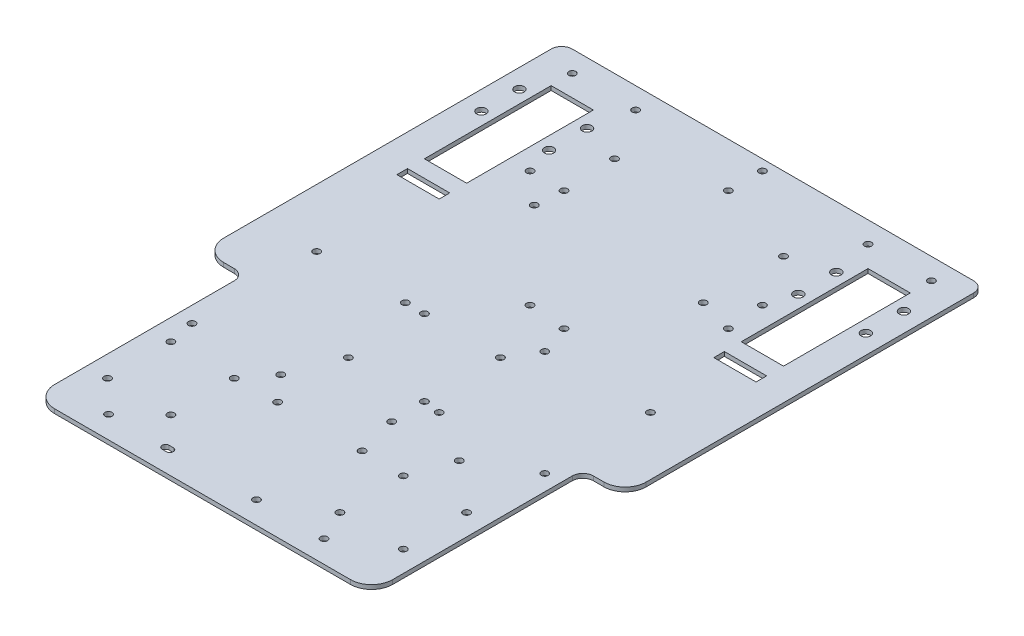
from build123d import *

# Parameters (mm, degrees)
SKETCH_1_R      = 1.65
SKETCH_1_R_2    = 2.25
SKETCH_1_W      = 20
SKETCH_1_H      = 60
SKETCH_1_H_2    = 5
EXTRUDE_1_DEPTH = 2


with BuildPart() as part:
    # 草图1 → 凸台-拉伸1 (new body)
    with BuildSketch(Plane(origin=(0, 0, 0), x_dir=(1, 0, 0), z_dir=(0, 1, 0))):
        with BuildLine():
            Line((85, 50), (90, 50))
            ThreePointArc((90, 50), (97.071067812, 52.928932188), (100, 60))
            Line((100, 60), (100, 215))
            ThreePointArc((100, 215), (98.535533906, 218.535533906), (95, 220))
            Line((95, 220), (-95, 220))
            ThreePointArc((-95, 220), (-98.535533906, 218.535533906), (-100, 215))
            Line((-100, 215), (-100, 60))
            ThreePointArc((-100, 60), (-97.071067812, 52.928932188), (-90, 50))
            Line((-90, 50), (-85, 50))
            ThreePointArc((-85, 50), (-81.464466094, 48.535533906), (-80, 45))
            Line((-80, 45), (-80, -40))
            ThreePointArc((-80, -40), (-77.071067812, -47.071067812), (-70, -50))
            Line((-70, -50), (70, -50))
            ThreePointArc((70, -50), (77.071067812, -47.071067812), (80, -40))
            Line((80, -40), (80, 45))
            ThreePointArc((80, 45), (81.464466094, 48.535533906), (85, 50))
        make_face()
        with Locations(Location((47, -39.5, 0), (0, 0, 270))):
            Circle(SKETCH_1_R, mode=Mode.SUBTRACT)
        with Locations(Location((-40, 5, 0), (0, 0, 270))):
            Circle(SKETCH_1_R, mode=Mode.SUBTRACT)
        with Locations(Location((-40, -25, 0), (0, 0, 270))):
            Circle(SKETCH_1_R, mode=Mode.SUBTRACT)
        with Locations(Location((-70, -25, 0), (0, 0, 270))):
            Circle(SKETCH_1_R, mode=Mode.SUBTRACT)
        with Locations(Location((-70, 5, 0), (0, 0, 270))):
            Circle(SKETCH_1_R, mode=Mode.SUBTRACT)
        with Locations(Location((70, 5, 0), (0, 0, 270))):
            Circle(SKETCH_1_R, mode=Mode.SUBTRACT)
        with Locations(Location((70, -25, 0), (0, 0, 270))):
            Circle(SKETCH_1_R, mode=Mode.SUBTRACT)
        with Locations(Location((40, -25, 0), (0, 0, 270))):
            Circle(SKETCH_1_R, mode=Mode.SUBTRACT)
        with Locations(Location((40, 5, 0), (0, 0, 270))):
            Circle(SKETCH_1_R, mode=Mode.SUBTRACT)
        with Locations(Location((47, 24.5, 0), (0, 0, 270))):
            Circle(SKETCH_1_R, mode=Mode.SUBTRACT)
        with Locations(Location((15, 24.5, 0), (0, 0, 270))):
            Circle(SKETCH_1_R, mode=Mode.SUBTRACT)
        with Locations(Location((15, -39.5, 0), (0, 0, 270))):
            Circle(SKETCH_1_R, mode=Mode.SUBTRACT)
        with Locations(Location((-30.5, 76.5, 0), (0, 0, 270))):
            Circle(SKETCH_1_R, mode=Mode.SUBTRACT)
        with Locations(Location((-72.5, 76.5, 0), (0, 0, 270))):
            Circle(SKETCH_1_R, mode=Mode.SUBTRACT)
        with Locations(Location((-30.5, 17.5, 0), (0, 0, 270))):
            Circle(SKETCH_1_R, mode=Mode.SUBTRACT)
        with Locations(Location((-72.5, 17.5, 0), (0, 0, 270))):
            Circle(SKETCH_1_R, mode=Mode.SUBTRACT)
        with Locations(Location((22.5, 89.5, 0), (0, 0, 270))):
            Circle(SKETCH_1_R, mode=Mode.SUBTRACT)
        with Locations(Location((72.5, 89.5, 0), (0, 0, 270))):
            Circle(SKETCH_1_R, mode=Mode.SUBTRACT)
        with Locations(Location((72.5, 39.5, 0), (0, 0, 270))):
            Circle(SKETCH_1_R, mode=Mode.SUBTRACT)
        with Locations(Location((22.5, 39.5, 0), (0, 0, 270))):
            Circle(SKETCH_1_R, mode=Mode.SUBTRACT)
        with Locations(Location((0, 215, 0), (0, 0, 270))):
            Circle(SKETCH_1_R, mode=Mode.SUBTRACT)
        with Locations(Location((-85, 210, 0), (0, 0, 270))):
            Circle(SKETCH_1_R, mode=Mode.SUBTRACT)
        with Locations(Location((-55, 210, 0), (0, 0, 270))):
            Circle(SKETCH_1_R, mode=Mode.SUBTRACT)
        with Locations(Location((85, 210, 0), (0, 0, 270))):
            Circle(SKETCH_1_R, mode=Mode.SUBTRACT)
        with Locations(Location((55, 210, 0), (0, 0, 270))):
            Circle(SKETCH_1_R, mode=Mode.SUBTRACT)
        with Locations(Location((55, 160, 0), (0, 0, 270))):
            Circle(SKETCH_1_R, mode=Mode.SUBTRACT)
        with Locations(Location((0, 105, 0), (0, 0, 270))):
            Circle(SKETCH_1_R, mode=Mode.SUBTRACT)
        with Locations(Location((-55, 160, 0), (0, 0, 270))):
            Circle(SKETCH_1_R, mode=Mode.SUBTRACT)
        with Locations(Location((-55, -39.5, 0), (0, 0, 270))):
            Circle(SKETCH_1_R, mode=Mode.SUBTRACT)
        with Locations(Location((-20, 5.5, 0), (0, 0, 270))):
            Circle(SKETCH_1_R, mode=Mode.SUBTRACT)
        with Locations(Location((20, 5.5, 0), (0, 0, 270))):
            Circle(SKETCH_1_R, mode=Mode.SUBTRACT)
        with Locations(Location((0, 198.890872965, 0), (0, 0, 270))):
            Circle(SKETCH_1_R, mode=Mode.SUBTRACT)
        with Locations(Location((-38.890872965, 160, 0), (0, 0, 270))):
            Circle(SKETCH_1_R, mode=Mode.SUBTRACT)
        with Locations(Location((17.67766953, 103.431457505, 0), (0, 0, 270))):
            Circle(SKETCH_1_R, mode=Mode.SUBTRACT)
        with Locations(Location((56.568542495, 142.32233047, 0), (0, 0, 270))):
            Circle(SKETCH_1_R, mode=Mode.SUBTRACT)
        with Locations(Location((-21.5, 76.5, 0), (0, 0, 270))):
            Circle(SKETCH_1_R, mode=Mode.SUBTRACT)
        with Locations(Location((14.5, 76.5, 0), (0, 0, 270))):
            Circle(SKETCH_1_R, mode=Mode.SUBTRACT)
        with Locations(Location((14.5, 40.5, 0), (0, 0, 270))):
            Circle(SKETCH_1_R, mode=Mode.SUBTRACT)
        with Locations(Location((-21.5, 40.5, 0), (0, 0, 270))):
            Circle(SKETCH_1_R, mode=Mode.SUBTRACT)
        with Locations(Location((-91, 191, 0), (0, 0, 270))):
            Circle(SKETCH_1_R_2, mode=Mode.SUBTRACT)
        with Locations(Location((-91, 173, 0), (0, 0, 270))):
            Circle(SKETCH_1_R_2, mode=Mode.SUBTRACT)
        with Locations(Location((-59, 191, 0), (0, 0, 270))):
            Circle(SKETCH_1_R_2, mode=Mode.SUBTRACT)
        with Locations(Location((-59, 173, 0), (0, 0, 270))):
            Circle(SKETCH_1_R_2, mode=Mode.SUBTRACT)
        with Locations(Location((91, 191, 0), (0, 0, 270))):
            Circle(SKETCH_1_R_2, mode=Mode.SUBTRACT)
        with Locations(Location((59, 191, 0), (0, 0, 270))):
            Circle(SKETCH_1_R_2, mode=Mode.SUBTRACT)
        with Locations(Location((59, 173, 0), (0, 0, 270))):
            Circle(SKETCH_1_R_2, mode=Mode.SUBTRACT)
        with Locations(Location((91, 173, 0), (0, 0, 270))):
            Circle(SKETCH_1_R_2, mode=Mode.SUBTRACT)
        with Locations(Location((-40, 185, 0), (0, 0, 270))):
            Circle(SKETCH_1_R, mode=Mode.SUBTRACT)
        with Locations(Location((-40, 147, 0), (0, 0, 270))):
            Circle(SKETCH_1_R, mode=Mode.SUBTRACT)
        with Locations(Location((40, 147, 0), (0, 0, 270))):
            Circle(SKETCH_1_R, mode=Mode.SUBTRACT)
        with Locations(Location((40, 185, 0), (0, 0, 270))):
            Circle(SKETCH_1_R, mode=Mode.SUBTRACT)
        with Locations((75, 170)):
            Rectangle(SKETCH_1_W, SKETCH_1_H, mode=Mode.SUBTRACT)
        with BuildLine():
            Line((-28, -37.85), (-26, -37.85))
            ThreePointArc((-26, -37.85), (-24.35, -39.5), (-26, -41.15))
            Line((-26, -41.15), (-28, -41.15))
            ThreePointArc((-28, -41.15), (-29.65, -39.5), (-28, -37.85))
        make_face(mode=Mode.SUBTRACT)
        with Locations((75, 129.5)):
            Rectangle(SKETCH_1_W, SKETCH_1_H_2, mode=Mode.SUBTRACT)
        with Locations((-75, 170)):
            Rectangle(SKETCH_1_W, SKETCH_1_H, mode=Mode.SUBTRACT)
        with Locations((-75, 129.5)):
            Rectangle(SKETCH_1_W, SKETCH_1_H_2, mode=Mode.SUBTRACT)
    extrude(amount=EXTRUDE_1_DEPTH)


solid = part.part
